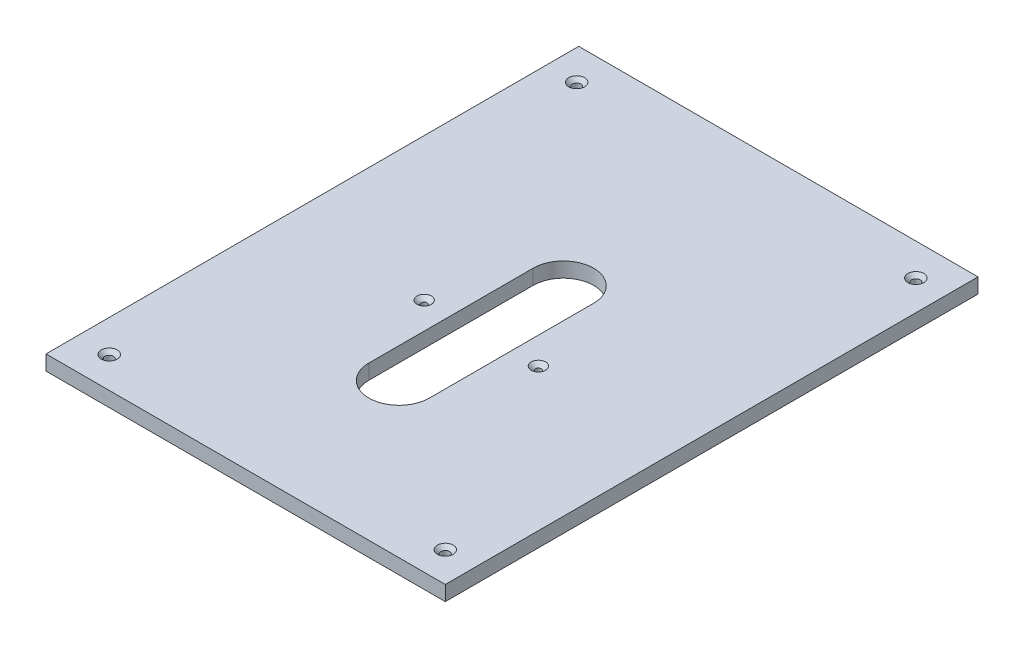
from build123d import *

# Parameters (mm, degrees)
SKETCH1_W                                       = 158
SKETCH1_H                                       = 210.8
BOSS_EXTRUDE1_DEPTH                             = 5.9
CSK_FOR_M3_FLAT_HEAD_MACHINE_SCREW1_D           = 3.4
CSK_FOR_M3_FLAT_HEAD_MACHINE_SCREW1_DEPTH       = 10
CSK_FOR_M3_FLAT_HEAD_MACHINE_SCREW1_CSINK_D     = 6.3
CSK_FOR_M3_FLAT_HEAD_MACHINE_SCREW1_CSINK_ANGLE = 90
CSK_FOR_M3_FLAT_HEAD_MACHINE_SCREW1_TIP         = 1.021463052
CUT_EXTRUDE1_DEPTH                              = 132.852076207
F_4_40_TAPPED_HOLE1_D                           = 2.2606
F_4_40_TAPPED_HOLE1_DEPTH                       = 10
F_4_40_TAPPED_HOLE1_CSINK_D                     = 5.715
F_4_40_TAPPED_HOLE1_CSINK_ANGLE                 = 100
F_4_40_TAPPED_HOLE1_TIP                         = 0.679152758


with BuildPart() as part:
    # Sketch1 → Boss-Extrude1 (new body)
    with BuildSketch(Plane(origin=(0, 0, 0), x_dir=(1, 0, 0), z_dir=(0, 1, 0))):
        Rectangle(SKETCH1_W, SKETCH1_H)
    extrude(amount=BOSS_EXTRUDE1_DEPTH)

    # CSK for M3 Flat Head Machine Screw1
    with Locations(Plane(origin=(0, 5.9, 0), x_dir=(1, 0, 0), z_dir=(0, 1, 0))):
        with Locations((67.1, 92.7), (67.1, -93.5), (-66.28397659, -93.1), (-67.1, 92.7)):
            CounterSinkHole(CSK_FOR_M3_FLAT_HEAD_MACHINE_SCREW1_D / 2, CSK_FOR_M3_FLAT_HEAD_MACHINE_SCREW1_CSINK_D / 2, depth=CSK_FOR_M3_FLAT_HEAD_MACHINE_SCREW1_DEPTH, counter_sink_angle=CSK_FOR_M3_FLAT_HEAD_MACHINE_SCREW1_CSINK_ANGLE)
            with Locations((0, 0, -(CSK_FOR_M3_FLAT_HEAD_MACHINE_SCREW1_DEPTH + CSK_FOR_M3_FLAT_HEAD_MACHINE_SCREW1_TIP / 2))):  # 118° drill point
                Cone(0, CSK_FOR_M3_FLAT_HEAD_MACHINE_SCREW1_D / 2, CSK_FOR_M3_FLAT_HEAD_MACHINE_SCREW1_TIP, mode=Mode.SUBTRACT)

    # Sketch4 → Cut-Extrude1 (cut, through all)
    with BuildSketch(Plane(origin=(0, 5.9, 0), x_dir=(1, 0, 0), z_dir=(0, 1, 0))):
        with BuildLine():
            Line((-11.991361004, 20.34), (-11.991361004, -44.66))
            add(Edge.make_bspline(
                [(-11.991361004, -44.66), (-11.991361004, -68.642722008), (11.991361004, -68.642722008), (11.991361004, -44.66)],
                knots=[0, 0, 0, 0, 1, 1, 1, 1], degree=3, weights=[1, 0.333333333, 0.333333333, 1]))
            Line((11.991361004, -44.66), (11.991361004, 20.34))
            add(Edge.make_bspline(
                [(11.991361004, 20.34), (11.991361004, 44.322722008), (-11.991361004, 44.322722008), (-11.991361004, 20.34)],
                knots=[0, 0, 0, 0, 1, 1, 1, 1], degree=3, weights=[1, 0.333333333, 0.333333333, 1]))
        make_face()
    extrude(amount=-CUT_EXTRUDE1_DEPTH, mode=Mode.SUBTRACT)

    # #4-40 Tapped Hole1
    with Locations(Plane(origin=(0, 5.9, 0), x_dir=(1, 0, 0), z_dir=(0, 1, 0))):
        with Locations((-22.6, -12.16), (22.6, -12.16)):
            CounterSinkHole(F_4_40_TAPPED_HOLE1_D / 2, F_4_40_TAPPED_HOLE1_CSINK_D / 2, depth=F_4_40_TAPPED_HOLE1_DEPTH, counter_sink_angle=F_4_40_TAPPED_HOLE1_CSINK_ANGLE)
            with Locations((0, 0, -(F_4_40_TAPPED_HOLE1_DEPTH + F_4_40_TAPPED_HOLE1_TIP / 2))):  # 118° drill point
                Cone(0, F_4_40_TAPPED_HOLE1_D / 2, F_4_40_TAPPED_HOLE1_TIP, mode=Mode.SUBTRACT)


solid = part.part
